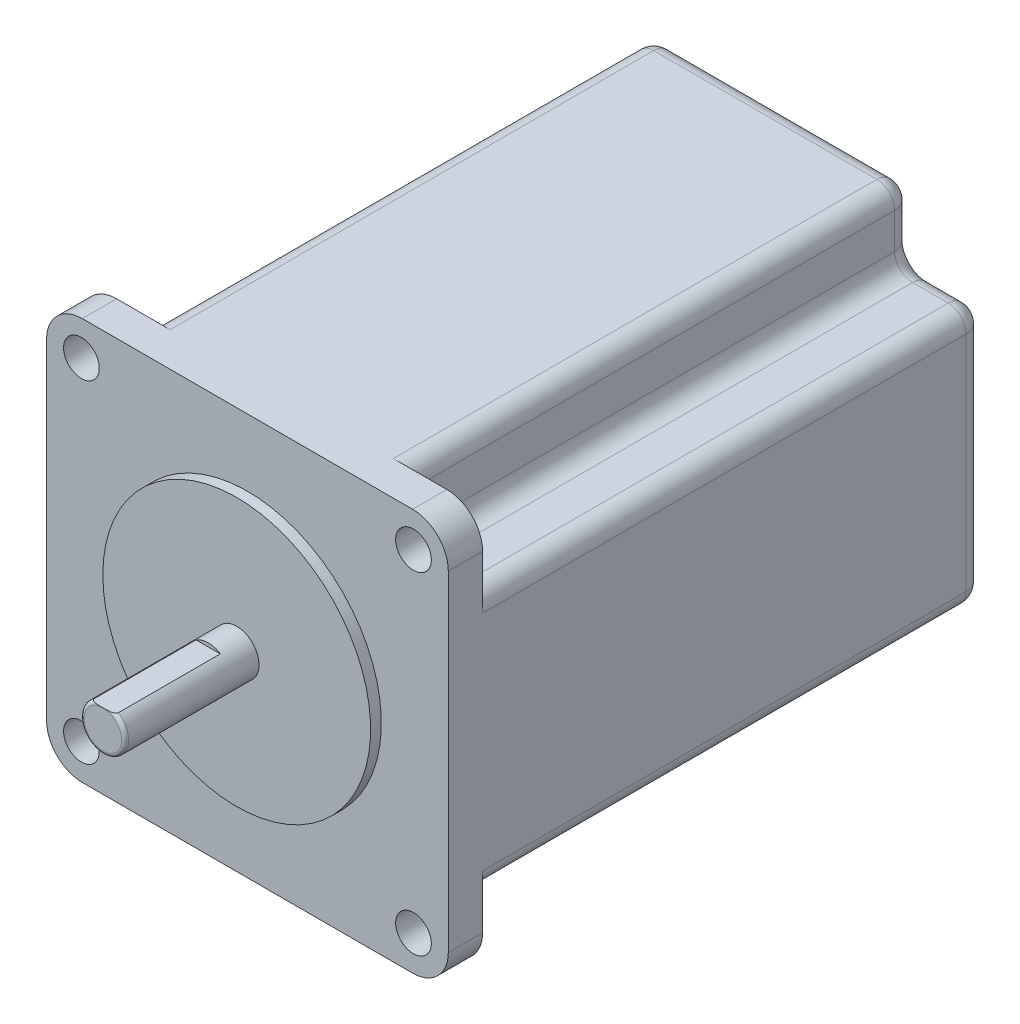
from build123d import *

# Parameters (mm, degrees)
SKETCH1_W           = 57.15
SKETCH1_H           = 57.15
BOSS_EXTRUDE1_DEPTH = 76.2
SKETCH2_R           = 19.05
BOSS_EXTRUDE2_DEPTH = 1.524
SKETCH3_R           = 3.175
BOSS_EXTRUDE3_DEPTH = 19.05
SKETCH18_W          = 20.32
SKETCH18_H          = 20.32
CUT_EXTRUDE13_DEPTH = 71.3232
SKETCH20_W          = 20.32
SKETCH20_H          = 20.32
CUT_EXTRUDE14_DEPTH = 71.3232
SKETCH21_W          = 20.32
SKETCH21_H          = 20.32
CUT_EXTRUDE15_DEPTH = 71.3232
SKETCH22_W          = 20.32
SKETCH22_H          = 20.32
CUT_EXTRUDE16_DEPTH = 71.3232
SKETCH11_R          = 2.54
CUT_EXTRUDE8_DEPTH  = 112.079633597
SKETCH12_R          = 2.54
CUT_EXTRUDE9_DEPTH  = 112.079633597
SKETCH14_R          = 2.54
CUT_EXTRUDE10_DEPTH = 112.079633597
SKETCH15_R          = 2.54
CUT_EXTRUDE11_DEPTH = 112.079633597
FILLET2_R           = 5.08
FILLET4_R           = 2.54
FILLET1_R           = 0.508
SKETCH10_W          = 7.148953117
SKETCH10_H          = 1.106198654
CUT_EXTRUDE7_DEPTH  = 14.986
SKETCH23_R          = 3.429
WIRE_2_DEPTH        = 5.842


with BuildPart() as part:
    # Sketch1 → Boss-Extrude1 (new body)
    with BuildSketch(Plane.XY):
        with Locations((28.575, 28.575)):
            Rectangle(SKETCH1_W, SKETCH1_H)
    extrude(amount=BOSS_EXTRUDE1_DEPTH)

    # Sketch2 → Boss-Extrude2 (add)
    with BuildSketch(Plane.XY.offset(76.2)):
        with Locations(Location((28.575, 28.575, 0), (0, 0, 180))):
            Circle(SKETCH2_R)
    extrude(amount=BOSS_EXTRUDE2_DEPTH)

    # Sketch3 → Boss-Extrude3 (add)
    with BuildSketch(Plane.XY.offset(77.724)):
        with Locations(Location((28.575, 28.575, 0), (0, 0, 180))):
            Circle(SKETCH3_R)
    extrude(amount=BOSS_EXTRUDE3_DEPTH)

    # Sketch18 → Cut-Extrude13 (cut)
    with BuildSketch(Plane(origin=(0, 0, 0), x_dir=(-1, 0, 0), z_dir=(0, 0, -1))):
        with Locations((0, 57.15)):
            Rectangle(SKETCH18_W, SKETCH18_H)
    extrude(amount=-CUT_EXTRUDE13_DEPTH, mode=Mode.SUBTRACT)

    # Sketch20 → Cut-Extrude14 (cut)
    with BuildSketch(Plane(origin=(0, 0, 0), x_dir=(-1, 0, 0), z_dir=(0, 0, -1))):
        Rectangle(SKETCH20_W, SKETCH20_H)
    extrude(amount=-CUT_EXTRUDE14_DEPTH, mode=Mode.SUBTRACT)

    # Sketch21 → Cut-Extrude15 (cut)
    with BuildSketch(Plane(origin=(0, 0, 0), x_dir=(-1, 0, 0), z_dir=(0, 0, -1))):
        with Locations((-57.15, 0)):
            Rectangle(SKETCH21_W, SKETCH21_H)
    extrude(amount=-CUT_EXTRUDE15_DEPTH, mode=Mode.SUBTRACT)

    # Sketch22 → Cut-Extrude16 (cut)
    with BuildSketch(Plane(origin=(0, 0, 0), x_dir=(-1, 0, 0), z_dir=(0, 0, -1))):
        with Locations((-57.15, 57.15)):
            Rectangle(SKETCH22_W, SKETCH22_H)
    extrude(amount=-CUT_EXTRUDE16_DEPTH, mode=Mode.SUBTRACT)

    # Sketch11 → Cut-Extrude8 (cut, through all)
    with BuildSketch(Plane.XY.offset(76.2)):
        with Locations((4.953, 52.233071325)):
            Circle(SKETCH11_R)
    extrude(amount=-CUT_EXTRUDE8_DEPTH, mode=Mode.SUBTRACT)

    # Sketch12 → Cut-Extrude9 (cut, through all)
    with BuildSketch(Plane.XY.offset(76.2)):
        with Locations((52.197, 52.233071325)):
            Circle(SKETCH12_R)
    extrude(amount=-CUT_EXTRUDE9_DEPTH, mode=Mode.SUBTRACT)

    # Sketch14 → Cut-Extrude10 (cut, through all)
    with BuildSketch(Plane.XY.offset(76.2)):
        with Locations((4.953, 4.989071325)):
            Circle(SKETCH14_R)
    extrude(amount=-CUT_EXTRUDE10_DEPTH, mode=Mode.SUBTRACT)

    # Sketch15 → Cut-Extrude11 (cut, through all)
    with BuildSketch(Plane.XY.offset(76.2)):
        with Locations((52.197, 4.989071325)):
            Circle(SKETCH15_R)
    extrude(amount=-CUT_EXTRUDE11_DEPTH, mode=Mode.SUBTRACT)

    # Fillet2
    fillet2_edges = [part.edges().sort_by_distance(p)[0] for p in [
        (0, 57.15, 73.7616),
        (57.15, 57.15, 73.7616),
        (57.15, 0, 73.7616),
        (0, 0, 73.7616),
    ]]
    fillet(fillet2_edges, radius=FILLET2_R)

    # Fillet4
    fillet4_edges = [part.edges().sort_by_distance(p)[0] for p in [
        (0, 28.575, 0),
        (10.16, 52.07, 0),
        (5.08, 46.99, 0),
        (0, 46.99, 35.6616),
        (10.16, 57.15, 35.6616),
        (10.16, 46.99, 35.6616),
        (28.575, 0, 0),
        (5.08, 10.16, 0),
        (10.16, 5.08, 0),
        (10.16, 0, 35.6616),
        (0, 10.16, 35.6616),
        (10.16, 10.16, 35.6616),
        (57.15, 28.575, 0),
        (46.99, 5.08, 0),
        (52.07, 10.16, 0),
        (57.15, 10.16, 35.6616),
        (46.99, 0, 35.6616),
        (46.99, 10.16, 35.6616),
        (28.575, 57.15, 0),
        (52.07, 46.99, 0),
        (46.99, 52.07, 0),
        (46.99, 57.15, 35.6616),
        (57.15, 46.99, 35.6616),
        (46.99, 46.99, 35.6616),
    ]]
    fillet(fillet4_edges, radius=FILLET4_R)

    # Fillet1
    fillet1_edges = [part.edges().sort_by_distance(p)[0] for p in [
        (31.75, 28.575, 96.774),
    ]]
    fillet(fillet1_edges, radius=FILLET1_R)

    # Sketch10 → Cut-Extrude7 (cut)
    with BuildSketch(Plane.XY.offset(96.774)):
        with Locations((29.031069878, 31.795099327)):
            Rectangle(SKETCH10_W, SKETCH10_H)
    extrude(amount=-CUT_EXTRUDE7_DEPTH, mode=Mode.SUBTRACT)

    # Sketch23 → Wire 2 (add)
    with BuildSketch(Plane.XZ):
        with Locations(Location((28.575, 7.343801428, 0), (0, 0, 90))):
            Circle(SKETCH23_R)
    extrude(amount=WIRE_2_DEPTH)


solid = part.part
